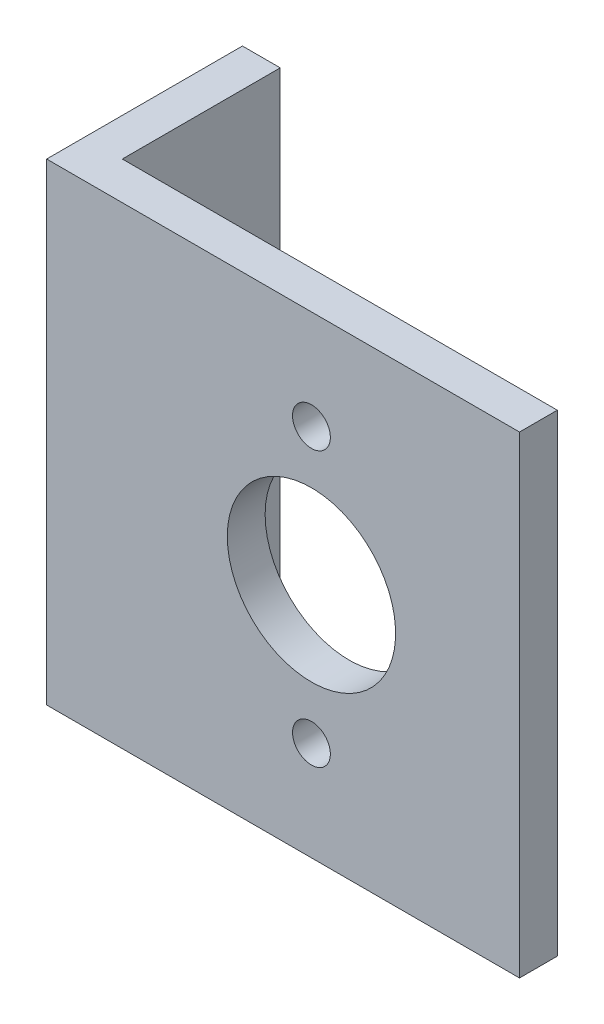
from build123d import *

# Parameters (mm, degrees)
EXTRUDE_1_DEPTH     = 50
SKETCH_2_R          = 3
CUT_EXTRUDE_1_DEPTH = 4
SKETCH_3_R          = 8.9
SKETCH_3_R_2        = 2
CUT_EXTRUDE_2_DEPTH = 4


with BuildPart() as part:
    # Эскиз1 → Бобышка-Вытянуть1 (new body)
    with BuildSketch(Plane(origin=(0, 0, 0), x_dir=(1, 0, 0), z_dir=(0, 1, 0))):
        Polygon((0, 0), (50, 0), (50, 4), (4, 4), (4, 20.7), (0, 20.7), (0, 4), align=None)
    extrude(amount=EXTRUDE_1_DEPTH)

    # Эскиз2 → Вырез-Вытянуть1 (cut)
    with BuildSketch(Plane.ZY):
        with Locations((-10, 35)):
            Circle(SKETCH_2_R)
        with Locations((-10, 15)):
            Circle(SKETCH_2_R)
    extrude(amount=-CUT_EXTRUDE_1_DEPTH, mode=Mode.SUBTRACT)

    # Эскиз3 → Вырез-Вытянуть2 (cut)
    with BuildSketch(Plane(origin=(0, 0, -4), x_dir=(-1, 0, 0), z_dir=(0, 0, -1))):
        with Locations((-28, 25)):
            Circle(SKETCH_3_R)
        with Locations((-28, 39.5)):
            Circle(SKETCH_3_R_2)
        with Locations((-28, 10.5)):
            Circle(SKETCH_3_R_2)
    extrude(amount=-CUT_EXTRUDE_2_DEPTH, mode=Mode.SUBTRACT)


solid = part.part
